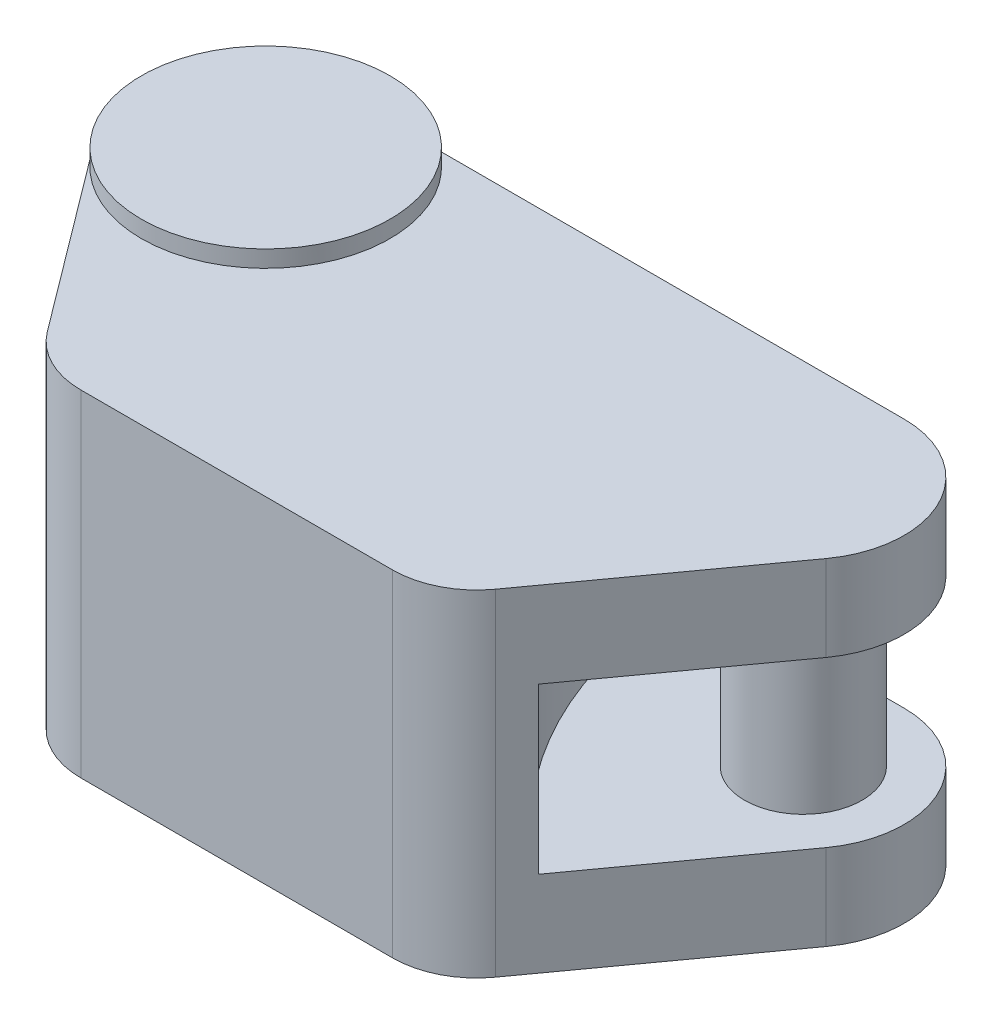
from build123d import *

# Parameters (mm, degrees)
BOSS_EXTRUDE2_DEPTH      = 63.5
BOSS_EXTRUDE2_DEPTH_BACK = 63.5
SKETCH3_R                = 46.99
BOSS_EXTRUDE3_DEPTH      = 6.35
CUT_EXTRUDE1_DEPTH       = 31.115
CUT_EXTRUDE1_DEPTH_BACK  = 31.115
BOSS_EXTRUDE4_DEPTH      = 31.115
BOSS_EXTRUDE4_DEPTH_BACK = 31.115
SKETCH5_R                = 22.225


with BuildPart() as part:
    # Sketch2 → Boss-Extrude2 (new, two sides: drawn at the far end of the back side and taken through both)
    with BuildSketch(Plane(origin=(0, 0, 0), x_dir=(0, 0, -1), z_dir=(0, 1, 0)).offset(-BOSS_EXTRUDE2_DEPTH_BACK)):
        with BuildLine():
            Line((-107.95, -38.1), (-107.95, -155.921006071))
            ThreePointArc((-107.95, -155.921006071), (-104.47415367, -170.365199862), (-94.807654535, -181.646823701))
            Line((-94.807654535, -181.646823701), (-22.329185441, -234.070981156))
            ThreePointArc((-22.329185441, -234.070981156), (17.333032549, -237.128984404), (38.1, -203.2))
            Line((38.1, -203.2), (38.1, -27.503637941))
            ThreePointArc((38.1, -27.503637941), (32.92252616, 33.528605269), (-28.194, 37.592))
            Line((-28.194, 37.592), (-95.25, -12.7))
            ThreePointArc((-95.25, -12.7), (-104.598063314, -23.900968343), (-107.95, -38.1))
        make_face()
    extrude(amount=BOSS_EXTRUDE2_DEPTH + BOSS_EXTRUDE2_DEPTH_BACK)

    # Sketch3 → Boss-Extrude3 (add)
    with BuildSketch(Plane(origin=(0, 63.5, 0), x_dir=(1, 0, 0), z_dir=(0, 1, 0))):
        Circle(SKETCH3_R)
    extrude(amount=BOSS_EXTRUDE3_DEPTH)

    # Sketch4 → Cut-Extrude1 (cut, two sides: drawn at the far end of the back side and taken through both)
    with BuildSketch(Plane(origin=(0, 0, 0), x_dir=(1, 0, 0), z_dir=(0, 1, 0)).offset(-CUT_EXTRUDE1_DEPTH_BACK)):
        with BuildLine():
            Line((125.379811821, 38.1), (277.779811821, 38.1))
            Line((277.779811821, 38.1), (188.463070055, -85.383924623))
            ThreePointArc((188.463070055, -85.383924623), (142.063874206, -31.232130195), (125.379811821, 38.1))
        make_face()
    extrude(amount=CUT_EXTRUDE1_DEPTH + CUT_EXTRUDE1_DEPTH_BACK, mode=Mode.SUBTRACT)

    # Sketch5 → Boss-Extrude4 (add, two sides: drawn at the far end of the back side and taken through both)
    with BuildSketch(Plane(origin=(0, 0, 0), x_dir=(1, 0, 0), z_dir=(0, 1, 0)).offset(-BOSS_EXTRUDE4_DEPTH_BACK)):
        with Locations((203.2, 0)):
            Circle(SKETCH5_R)
    extrude(amount=BOSS_EXTRUDE4_DEPTH + BOSS_EXTRUDE4_DEPTH_BACK)


solid = part.part
